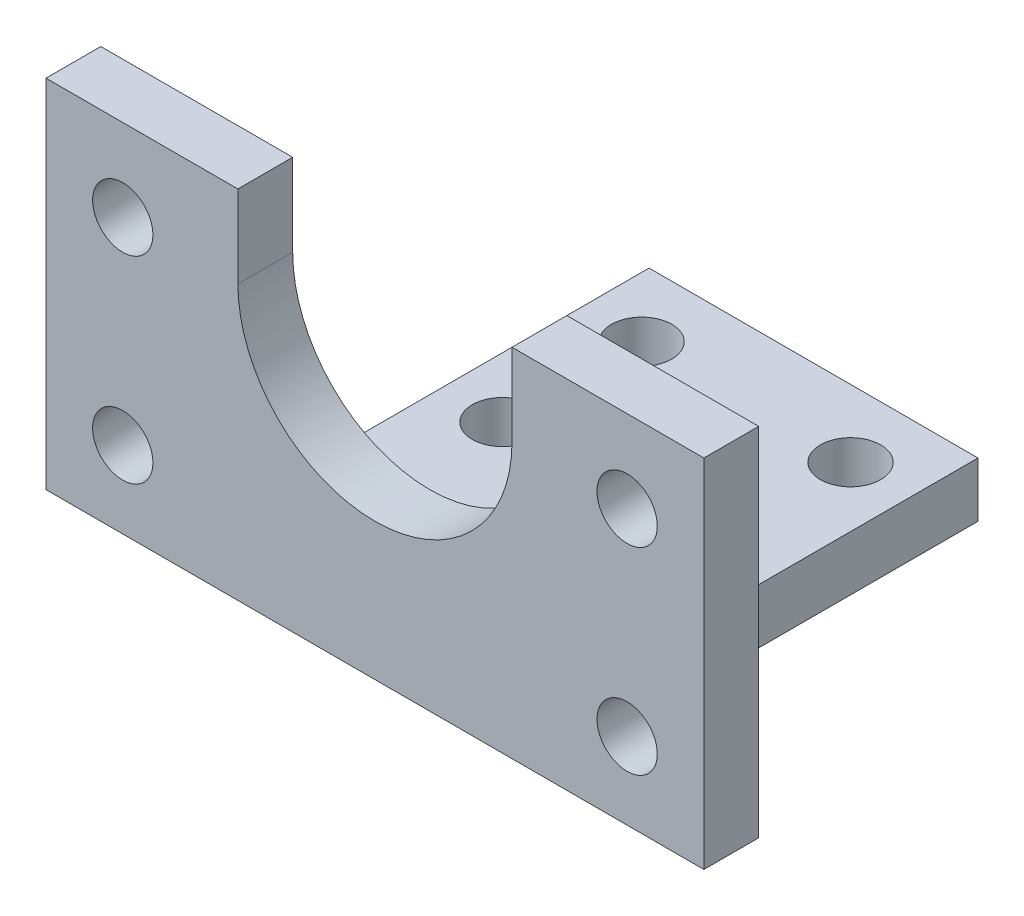
from build123d import *

# Parameters (mm, degrees)
SKETCH1_R           = 2.75
BOSS_EXTRUDE1_DEPTH = 5
SKETCH2_W           = 30
SKETCH2_H           = 40
SKETCH2_R           = 2.75
BOSS_EXTRUDE2_DEPTH = 5


with BuildPart() as part:
    # Sketch1 → Boss-Extrude1 (new body)
    with BuildSketch(Plane.XY):
        with BuildLine():
            Line((0, 32.5), (0, 0))
            Line((0, 0), (60, 0))
            Line((60, 0), (60, 32.5))
            Line((60, 32.5), (42.5, 32.5))
            Line((42.5, 32.5), (42.5, 25))
            ThreePointArc((42.5, 25), (30, 12.5), (17.5, 25))
            Line((17.5, 25), (17.5, 32.5))
            Line((17.5, 32.5), (0, 32.5))
        make_face()
        with Locations((7, 7)):
            Circle(SKETCH1_R, mode=Mode.SUBTRACT)
        with Locations((53, 7)):
            Circle(SKETCH1_R, mode=Mode.SUBTRACT)
        with Locations((7, 25)):
            Circle(SKETCH1_R, mode=Mode.SUBTRACT)
        with Locations((53, 25)):
            Circle(SKETCH1_R, mode=Mode.SUBTRACT)
    extrude(amount=BOSS_EXTRUDE1_DEPTH)

    # Sketch2 → Boss-Extrude2 (add)
    with BuildSketch(Plane.XZ):
        with Locations((30, -15)):
            Rectangle(SKETCH2_W, SKETCH2_H)
        with Locations(Location((20.475, -16.15, 0), (0, 0, 270))):
            Circle(SKETCH2_R, mode=Mode.SUBTRACT)
        with Locations(Location((39.525, -16.15, 0), (0, 0, 270))):
            Circle(SKETCH2_R, mode=Mode.SUBTRACT)
        with Locations(Location((39.525, -28.85, 0), (0, 0, 270))):
            Circle(SKETCH2_R, mode=Mode.SUBTRACT)
        with Locations(Location((20.475, -28.85, 0), (0, 0, 270))):
            Circle(SKETCH2_R, mode=Mode.SUBTRACT)
    extrude(amount=-BOSS_EXTRUDE2_DEPTH)


solid = part.part
